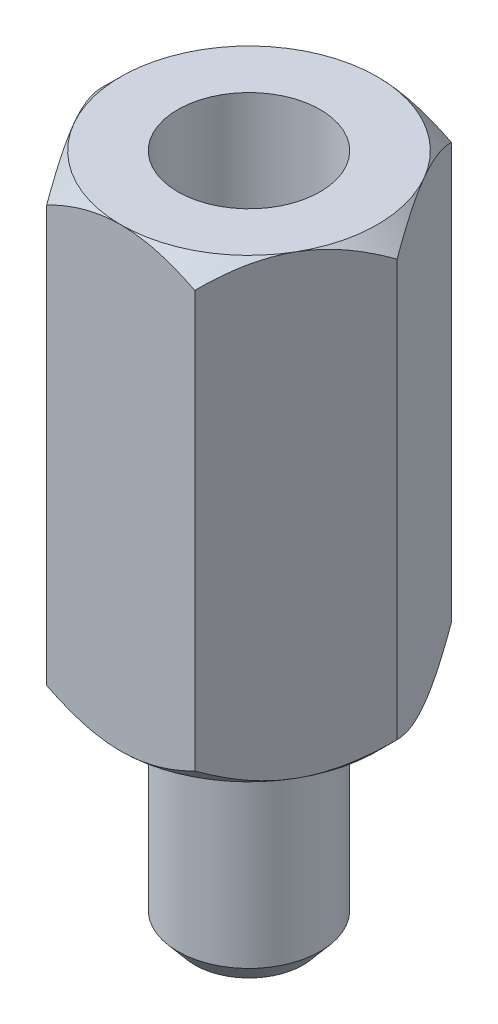
from build123d import *

# Parameters (mm, degrees)
SKETCH1_R           = 1.25
BOSS_EXTRUDE1_DEPTH = 3.9
BOSS_EXTRUDE2_DEPTH = 8
CUT_EXTRUDE1_START  = -4.8
SKETCH3_R           = 1.25
CUT_EXTRUDE1_DEPTH  = 4.8
SKETCH5_OUTSIDE_W   = 36.718
SKETCH5_OUTSIDE_H   = 36.022
SKETCH5_OUTSIDE_R   = 2.25
CUT_EXTRUDE3_DEPTH  = 13.386383653
CUT_EXTRUDE3_DRAFT  = -45
SKETCH6_OUTSIDE_W   = 29.358
SKETCH6_OUTSIDE_H   = 28.662
SKETCH6_OUTSIDE_R   = 2.25
CUT_EXTRUDE6_DEPTH  = 9.707037384
CUT_EXTRUDE6_DRAFT  = -45
CHAMFER1_SIZE       = 0.3
CHAMFER1_SIZE2      = 0.357526078


with BuildPart() as part:
    # Sketch1 → Boss-Extrude1 (new body)
    with BuildSketch(Plane(origin=(0, 0, 0), x_dir=(1, 0, 0), z_dir=(0, 1, 0))):
        with Locations(Location((0, 0, 0), (0, 0, 270))):
            Circle(SKETCH1_R)
    extrude(amount=BOSS_EXTRUDE1_DEPTH)

    # Sketch2 → Boss-Extrude2 (add)
    with BuildSketch(Plane(origin=(0, 3.9, 0), x_dir=(1, 0, 0), z_dir=(0, 1, 0))):
        Polygon((2.598076211, 0), (1.299038106, 2.25), (-1.299038106, 2.25), (-2.598076211, 0), (-1.299038106, -2.25), (1.299038106, -2.25), align=None)
    extrude(amount=BOSS_EXTRUDE2_DEPTH)

    # Sketch3 → Cut-Extrude1 (cut)
    with BuildSketch(Plane(origin=(0, 11.9, 0), x_dir=(1, 0, 0), z_dir=(0, 1, 0)).offset(CUT_EXTRUDE1_START)):
        with Locations(Location((0, 0, 0), (0, 0, 270))):
            Circle(SKETCH3_R)
    extrude(amount=CUT_EXTRUDE1_DEPTH, mode=Mode.SUBTRACT)


with BuildPart() as cut_extrude3_tool:
    # Sketch5 outside → Cut-Extrude3 (with draft: the straight prism first)
    with BuildSketch(Plane(origin=(0, 11.9, 0), x_dir=(1, 0, 0), z_dir=(0, 1, 0))):
        Rectangle(SKETCH5_OUTSIDE_W, SKETCH5_OUTSIDE_H)
        Circle(SKETCH5_OUTSIDE_R, mode=Mode.SUBTRACT)
    extrude(amount=-CUT_EXTRUDE3_DEPTH)
    # Cut-Extrude3: the draft: its side faces are tilted about the plane it starts from
    cut_extrude3_sides = [cut_extrude3_tool.faces().sort_by_distance(p)[0] for p in [
        (0, 5.206808173, 18.011),
        (18.359, 5.206808173, 0),
        (0, 5.206808173, -18.011),
        (-18.359, 5.206808173, 0),
        (-2.25, 5.206808173, 0),
    ]]
    draft(cut_extrude3_sides, Plane(origin=(0, 11.9, 0), x_dir=(1, 0, 0), z_dir=(0, 1, 0)), CUT_EXTRUDE3_DRAFT)


with BuildPart() as part_1:
    add(part.part)

    # Cut-Extrude3: cut by cut_extrude3_tool
    add(cut_extrude3_tool.part, mode=Mode.SUBTRACT)


with BuildPart() as cut_extrude6_tool:
    # Sketch6 outside → Cut-Extrude6 (with draft: the straight prism first)
    with BuildSketch(Plane.XZ.offset(-3.9)):
        Rectangle(SKETCH6_OUTSIDE_W, SKETCH6_OUTSIDE_H)
        Circle(SKETCH6_OUTSIDE_R, mode=Mode.SUBTRACT)
    extrude(amount=-CUT_EXTRUDE6_DEPTH)
    # Cut-Extrude6: the draft: its side faces are tilted about the plane it starts from
    cut_extrude6_sides = [cut_extrude6_tool.faces().sort_by_distance(p)[0] for p in [
        (0, 8.753518692, -14.331),
        (14.679, 8.753518692, 0),
        (0, 8.753518692, 14.331),
        (-14.679, 8.753518692, 0),
        (-2.25, 8.753518692, 0),
    ]]
    draft(cut_extrude6_sides, Plane.XZ.offset(-3.9), CUT_EXTRUDE6_DRAFT)


with BuildPart() as part_2:
    add(part_1.part)

    # Cut-Extrude6: cut by cut_extrude6_tool
    add(cut_extrude6_tool.part, mode=Mode.SUBTRACT)

    # Chamfer1
    chamfer1_edges = [part_2.edges().sort_by_distance(p)[0] for p in [
        (0, 0, -1.25),
    ]]
    chamfer1_side = [part_2.faces().sort_by_distance(p)[0] for p in [
        (0, 0, 0),
    ]]
    chamfer(chamfer1_edges, length=CHAMFER1_SIZE, length2=CHAMFER1_SIZE2, reference=chamfer1_side[0])


solid = part_2.part
